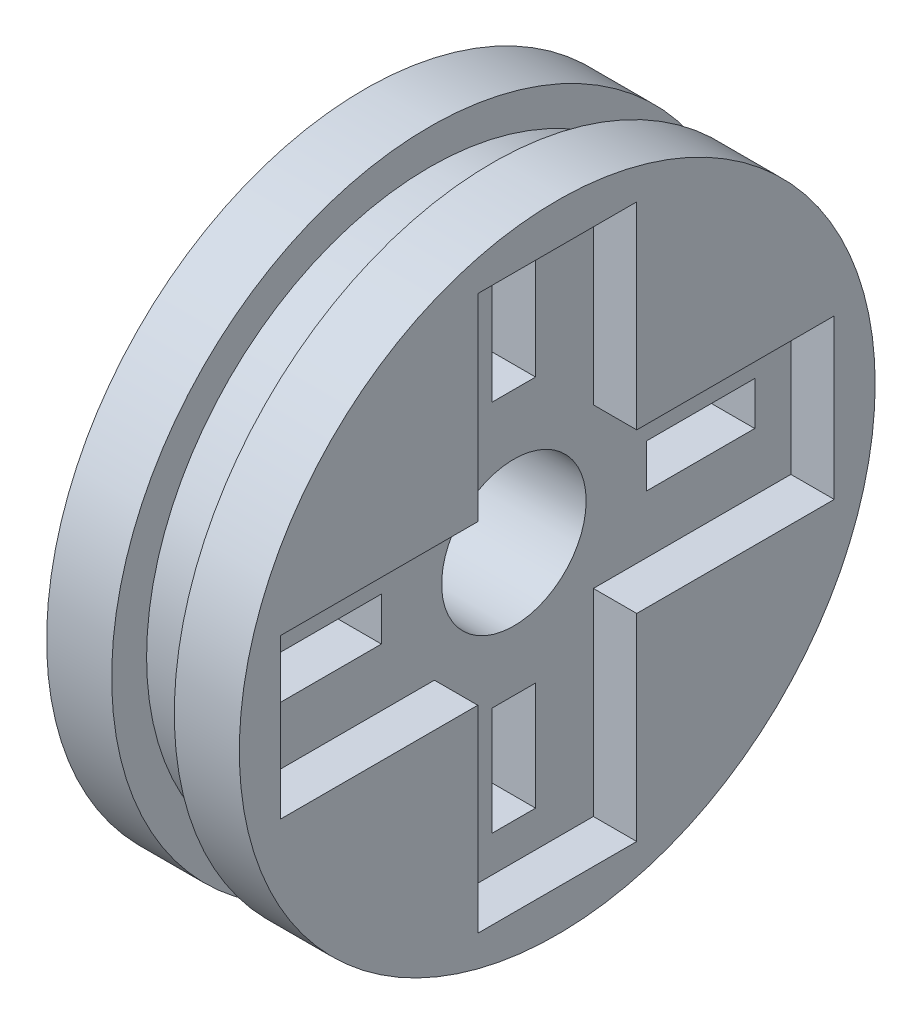
from build123d import *

# Parameters (mm, degrees)
BOSS_EXTRUDE1_START  = -85.2
SKETCH1_R            = 13.2
BOSS_EXTRUDE1_DEPTH  = 8
BOSS_EXTRUDE2_START  = -82.5
SKETCH2_R            = 20
BOSS_EXTRUDE2_DEPTH  = 2.6
BOSS_EXTRUDE3_START  = -82.5
SKETCH3_R            = 11.75
BOSS_EXTRUDE3_DEPTH  = 2.6
BOSS_EXTRUDE4_START  = -79
SKETCH4_R            = 4.6
BOSS_EXTRUDE4_DEPTH  = 2.3
BOSS_EXTRUDE5_START  = 62.7
SKETCH5_W            = 2.3
SKETCH5_H            = 11.5
BOSS_EXTRUDE5_DEPTH  = 6.6
BOSS_EXTRUDE6_START  = 65.1
SKETCH6_W            = 10
SKETCH6_H            = 4.5
BOSS_EXTRUDE6_DEPTH  = 1.8
BOSS_EXTRUDE7_START  = 62.7
SKETCH7_W            = 2.3
SKETCH7_H            = 11.5
BOSS_EXTRUDE7_DEPTH  = 6.6
BOSS_EXTRUDE8_START  = 65.1
SKETCH8_W            = 10
SKETCH8_H            = 4.5
BOSS_EXTRUDE8_DEPTH  = 1.8
BOSS_EXTRUDE9_START  = 66
SKETCH9_W            = 2.3
SKETCH9_H            = 6.6
BOSS_EXTRUDE9_DEPTH  = 11.5
BOSS_EXTRUDE10_START = 71.5
SKETCH10_W           = 10
SKETCH10_H           = 1.8
BOSS_EXTRUDE10_DEPTH = 4.5
BOSS_EXTRUDE11_START = 54.5
SKETCH11_W           = 2.3
SKETCH11_H           = 6.6
BOSS_EXTRUDE11_DEPTH = 11.5
BOSS_EXTRUDE12_START = 56
SKETCH12_W           = 10
SKETCH12_H           = 1.8
BOSS_EXTRUDE12_DEPTH = 4.5
BOSS_EXTRUDE13_START = -86.2
SKETCH13_R           = 3
BOSS_EXTRUDE13_DEPTH = 10


with BuildPart() as part:
    # Sketch1 → Boss-Extrude1 (new body)
    with BuildSketch(Plane(origin=(0, 0, 0), x_dir=(0, 0, -1), z_dir=(1, 0, 0)).offset(BOSS_EXTRUDE1_START)):
        with Locations((-66, -65)):
            Circle(SKETCH1_R)
    extrude(amount=BOSS_EXTRUDE1_DEPTH)


with BuildPart() as body_2:
    # Sketch2 → Boss-Extrude2 (new body)
    with BuildSketch(Plane(origin=(0, 0, 0), x_dir=(0, 0, -1), z_dir=(1, 0, 0)).offset(BOSS_EXTRUDE2_START)):
        with Locations((-66, -65)):
            Circle(SKETCH2_R)
    extrude(amount=BOSS_EXTRUDE2_DEPTH)


with BuildPart() as part_1:
    add(part.part)

    # Combine1: cut body 2
    add(body_2.part, mode=Mode.SUBTRACT)

    # Sketch3 → Boss-Extrude3 (add)
    with BuildSketch(Plane(origin=(0, 0, 0), x_dir=(0, 0, -1), z_dir=(1, 0, 0)).offset(BOSS_EXTRUDE3_START)):
        with Locations((-66, -65)):
            Circle(SKETCH3_R)
    extrude(amount=BOSS_EXTRUDE3_DEPTH)


with BuildPart() as body_2_2:
    # Sketch4 → Boss-Extrude4 (new body)
    with BuildSketch(Plane(origin=(0, 0, 0), x_dir=(0, 0, -1), z_dir=(1, 0, 0)).offset(BOSS_EXTRUDE4_START)):
        with Locations((-66, -65)):
            Circle(SKETCH4_R)
    extrude(amount=BOSS_EXTRUDE4_DEPTH)


with BuildPart() as part_2:
    add(part_1.part)

    # Combine2: cut body 2 2
    add(body_2_2.part, mode=Mode.SUBTRACT)


with BuildPart() as body_2_3:
    # Sketch5 → Boss-Extrude5 (new body)
    with BuildSketch(Plane.XY.offset(BOSS_EXTRUDE5_START)):
        with Locations((-77.85, -59.25)):
            Rectangle(SKETCH5_W, SKETCH5_H)
    extrude(amount=BOSS_EXTRUDE5_DEPTH)


with BuildPart() as part_3:
    add(part_2.part)

    # Combine3: cut body 2 3
    add(body_2_3.part, mode=Mode.SUBTRACT)


with BuildPart() as body_2_4:
    # Sketch6 → Boss-Extrude6 (new body)
    with BuildSketch(Plane.XY.offset(BOSS_EXTRUDE6_START)):
        with Locations((-81.2, -57.25)):
            Rectangle(SKETCH6_W, SKETCH6_H)
    extrude(amount=BOSS_EXTRUDE6_DEPTH)


with BuildPart() as part_4:
    add(part_3.part)

    # Combine4: cut body 2 4
    add(body_2_4.part, mode=Mode.SUBTRACT)


with BuildPart() as body_2_5:
    # Sketch7 → Boss-Extrude7 (new body)
    with BuildSketch(Plane.XY.offset(BOSS_EXTRUDE7_START)):
        with Locations((-77.85, -70.75)):
            Rectangle(SKETCH7_W, SKETCH7_H)
    extrude(amount=BOSS_EXTRUDE7_DEPTH)


with BuildPart() as part_5:
    add(part_4.part)

    # Combine5: cut body 2 5
    add(body_2_5.part, mode=Mode.SUBTRACT)


with BuildPart() as body_2_6:
    # Sketch8 → Boss-Extrude8 (new body)
    with BuildSketch(Plane.XY.offset(BOSS_EXTRUDE8_START)):
        with Locations((-81.2, -72.75)):
            Rectangle(SKETCH8_W, SKETCH8_H)
    extrude(amount=BOSS_EXTRUDE8_DEPTH)


with BuildPart() as part_6:
    add(part_5.part)

    # Combine6: cut body 2 6
    add(body_2_6.part, mode=Mode.SUBTRACT)


with BuildPart() as body_2_7:
    # Sketch9 → Boss-Extrude9 (new body)
    with BuildSketch(Plane.XY.offset(BOSS_EXTRUDE9_START)):
        with Locations((-77.85, -65)):
            Rectangle(SKETCH9_W, SKETCH9_H)
    extrude(amount=BOSS_EXTRUDE9_DEPTH)


with BuildPart() as part_7:
    add(part_6.part)

    # Combine7: cut body 2 7
    add(body_2_7.part, mode=Mode.SUBTRACT)


with BuildPart() as body_2_8:
    # Sketch10 → Boss-Extrude10 (new body)
    with BuildSketch(Plane.XY.offset(BOSS_EXTRUDE10_START)):
        with Locations((-81.2, -65)):
            Rectangle(SKETCH10_W, SKETCH10_H)
    extrude(amount=BOSS_EXTRUDE10_DEPTH)


with BuildPart() as part_8:
    add(part_7.part)

    # Combine8: cut body 2 8
    add(body_2_8.part, mode=Mode.SUBTRACT)


with BuildPart() as body_2_9:
    # Sketch11 → Boss-Extrude11 (new body)
    with BuildSketch(Plane.XY.offset(BOSS_EXTRUDE11_START)):
        with Locations((-77.85, -65)):
            Rectangle(SKETCH11_W, SKETCH11_H)
    extrude(amount=BOSS_EXTRUDE11_DEPTH)


with BuildPart() as part_9:
    add(part_8.part)

    # Combine9: cut body 2 9
    add(body_2_9.part, mode=Mode.SUBTRACT)


with BuildPart() as body_2_10:
    # Sketch12 → Boss-Extrude12 (new body)
    with BuildSketch(Plane.XY.offset(BOSS_EXTRUDE12_START)):
        with Locations((-81.2, -65)):
            Rectangle(SKETCH12_W, SKETCH12_H)
    extrude(amount=BOSS_EXTRUDE12_DEPTH)


with BuildPart() as part_10:
    add(part_9.part)

    # Combine10: cut body 2 10
    add(body_2_10.part, mode=Mode.SUBTRACT)


with BuildPart() as body_2_11:
    # Sketch13 → Boss-Extrude13 (new body)
    with BuildSketch(Plane(origin=(0, 0, 0), x_dir=(0, 0, -1), z_dir=(1, 0, 0)).offset(BOSS_EXTRUDE13_START)):
        with Locations((-66, -65)):
            Circle(SKETCH13_R)
    extrude(amount=BOSS_EXTRUDE13_DEPTH)


with BuildPart() as part_11:
    add(part_10.part)

    # Combine11: cut body 2 11
    add(body_2_11.part, mode=Mode.SUBTRACT)


solid = part_11.part
